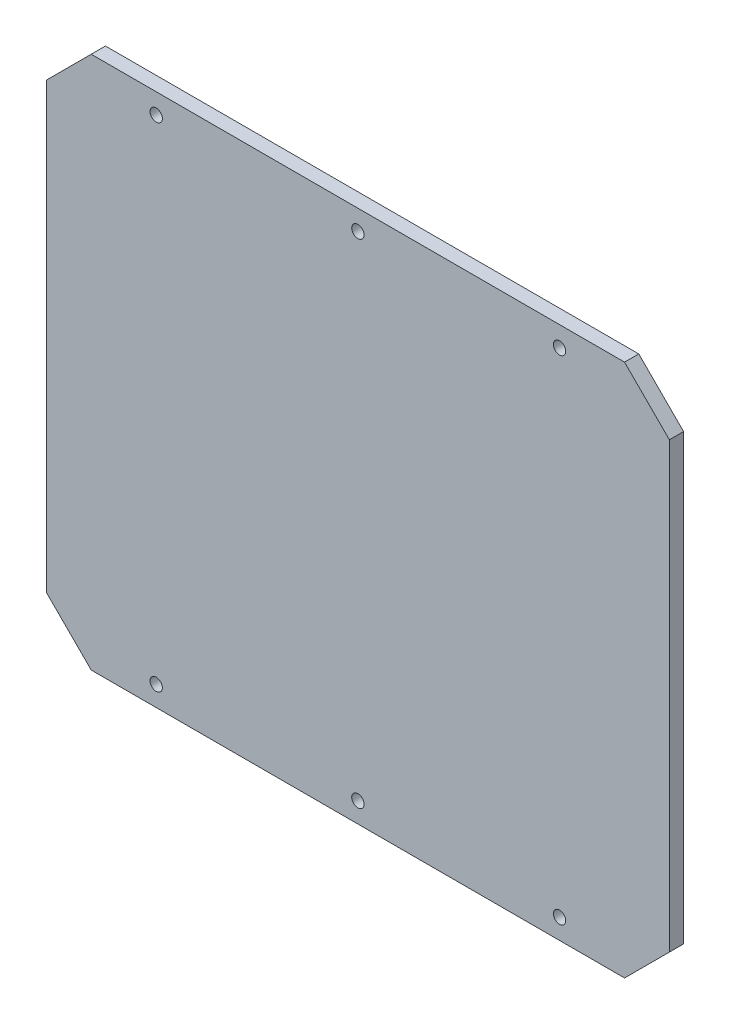
from build123d import *

# Parameters (mm, degrees)
SKETCH1_W           = 278
SKETCH1_H           = 238
BOSS_EXTRUDE1_DEPTH = 6.35
CHAMFER1_SIZE       = 20
SKETCH4_R           = 2.75
CUT_EXTRUDE2_DEPTH  = 76.2


with BuildPart() as part:
    # Sketch1 → Boss-Extrude1 (new body)
    with BuildSketch(Plane.XY):
        Rectangle(SKETCH1_W, SKETCH1_H)
    extrude(amount=BOSS_EXTRUDE1_DEPTH)

    # Chamfer1
    chamfer1_edges = [part.edges().sort_by_distance(p)[0] for p in [
        (-139, 119, 3.175),
        (139, 119, 3.175),
        (139, -119, 3.175),
        (-139, -119, 3.175),
    ]]
    chamfer(chamfer1_edges, length=CHAMFER1_SIZE)

    # Sketch4 → Cut-Extrude2 (cut)
    with BuildSketch(Plane.XY.offset(6.35)):
        with Locations((-90, 110)):
            Circle(SKETCH4_R)
        with Locations((0, 110)):
            Circle(SKETCH4_R)
        with Locations((90, 110)):
            Circle(SKETCH4_R)
        with Locations((90, -110)):
            Circle(SKETCH4_R)
        with Locations((0, -110)):
            Circle(SKETCH4_R)
        with Locations((-90, -110)):
            Circle(SKETCH4_R)
    extrude(amount=-CUT_EXTRUDE2_DEPTH, mode=Mode.SUBTRACT)


solid = part.part
